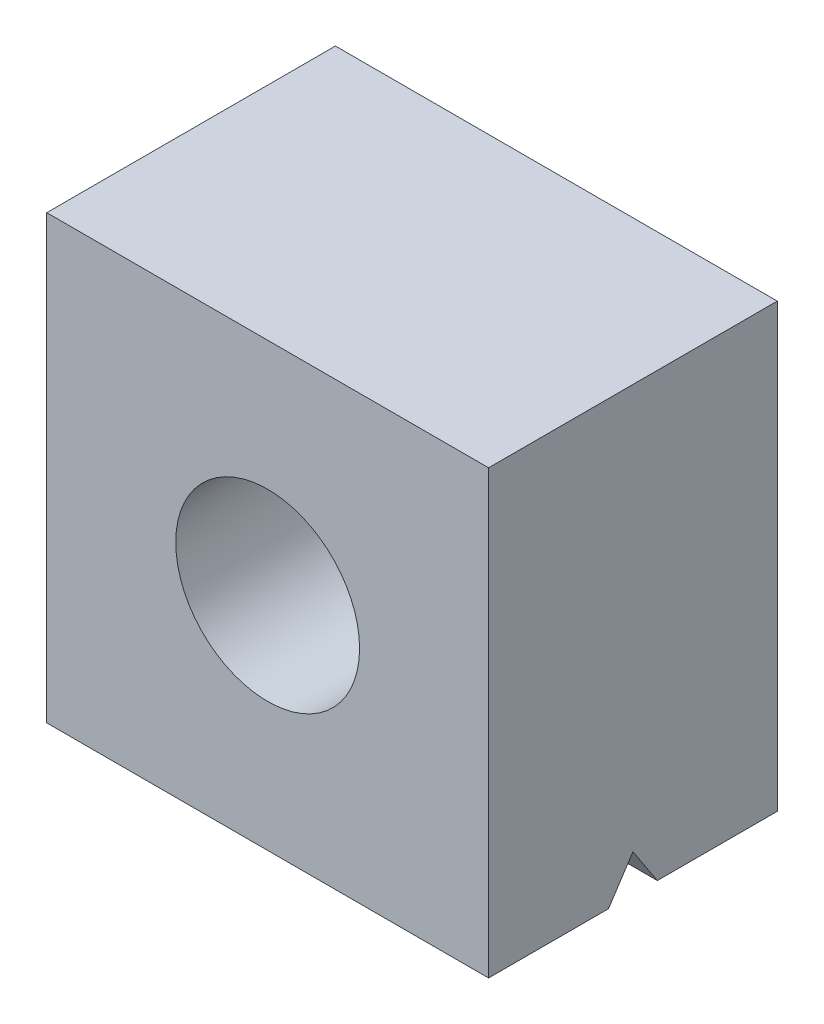
from build123d import *

# Parameters (mm, degrees)
SKETCH3_W               = 19.05
SKETCH3_H               = 19.05
BOSS_EXTRUDE2_DEPTH     = 12.446
SKETCH4_R               = 3.9624
CUT_EXTRUDE2_DEPTH      = 19.339960905
CUT_EXTRUDE3_DEPTH      = 19.339960905
CUT_EXTRUDE3_DEPTH_BACK = 19.339960905


with BuildPart() as part:
    # Sketch3 → Boss-Extrude2 (new body)
    with BuildSketch(Plane.XY):
        Rectangle(SKETCH3_W, SKETCH3_H)
    extrude(amount=BOSS_EXTRUDE2_DEPTH)

    # Sketch4 → Cut-Extrude2 (cut, through all)
    with BuildSketch(Plane.XY.offset(12.446)):
        Circle(SKETCH4_R)
    extrude(amount=-CUT_EXTRUDE2_DEPTH, mode=Mode.SUBTRACT)

    # Sketch9 → Cut-Extrude3 (cut, two sides: drawn at the far end of the back side and taken through both)
    with BuildSketch(Plane(origin=(0, 0, 0), x_dir=(0, 0, -1), z_dir=(1, 0, 0)).offset(-CUT_EXTRUDE3_DEPTH_BACK)):
        Polygon((-35.189020778, -51.950244205), (-7.275832681, -9.525), (-6.223, -7.9248), (-5.170167319, -9.525), (22.743020778, -51.950244205), (22.743020778, -153.518889278), (-35.189020778, -153.518889278), align=None)
    extrude(amount=CUT_EXTRUDE3_DEPTH + CUT_EXTRUDE3_DEPTH_BACK, mode=Mode.SUBTRACT)


solid = part.part
